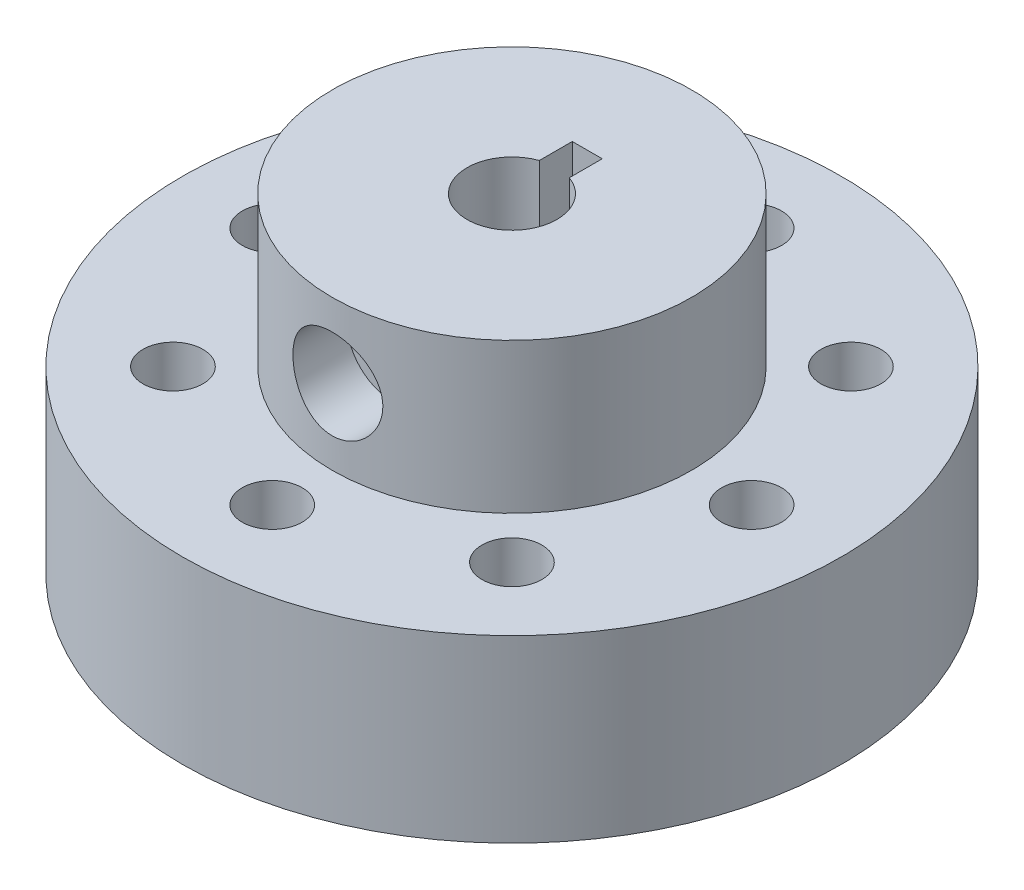
from build123d import *

# Parameters (mm, degrees)
SKETCH1_R           = 11
SKETCH1_R_2         = 1
BOSS_EXTRUDE1_DEPTH = 6
SKETCH2_R           = 4
CUT_EXTRUDE1_DEPTH  = 5.5
SKETCH3_R           = 6
BOSS_EXTRUDE2_DEPTH = 5
SKETCH6_R           = 1
CUT_EXTRUDE2_DEPTH  = 6
SKETCH6_3_R         = 1.5
SKETCH6_3_R_2       = 1
CUT_EXTRUDE3_DEPTH  = 2


with BuildPart() as part:
    # Sketch1 → Boss-Extrude1 (new body)
    with BuildSketch(Plane(origin=(0, 0, 0), x_dir=(1, 0, 0), z_dir=(0, 1, 0))):
        Circle(SKETCH1_R)
        with Locations((0, 8)):
            Circle(SKETCH1_R_2, mode=Mode.SUBTRACT)
        with Locations((5.656854249, 5.656854249)):
            Circle(SKETCH1_R_2, mode=Mode.SUBTRACT)
        with Locations((8, 0)):
            Circle(SKETCH1_R_2, mode=Mode.SUBTRACT)
        with Locations((5.656854249, -5.656854249)):
            Circle(SKETCH1_R_2, mode=Mode.SUBTRACT)
        with Locations((0, -8)):
            Circle(SKETCH1_R_2, mode=Mode.SUBTRACT)
        with Locations((-5.656854249, -5.656854249)):
            Circle(SKETCH1_R_2, mode=Mode.SUBTRACT)
        with Locations((-8, 0)):
            Circle(SKETCH1_R_2, mode=Mode.SUBTRACT)
        with Locations((-5.656854249, 5.656854249)):
            Circle(SKETCH1_R_2, mode=Mode.SUBTRACT)
    extrude(amount=BOSS_EXTRUDE1_DEPTH)

    # Sketch2 → Cut-Extrude1 (cut)
    with BuildSketch(Plane.XZ):
        Circle(SKETCH2_R)
    extrude(amount=-CUT_EXTRUDE1_DEPTH, mode=Mode.SUBTRACT)

    # Sketch3 → Boss-Extrude2 (add)
    with BuildSketch(Plane(origin=(0, 6, 0), x_dir=(1, 0, 0), z_dir=(0, 1, 0))):
        Circle(SKETCH3_R)
        with BuildLine():
            ThreePointArc((1.5, 0), (-0.866025404, -1.224744871), (-0.5, 1.414213562))
            Line((-0.5, 1.414213562), (-0.5, 2.514213562))
            Line((-0.5, 2.514213562), (0.5, 2.514213562))
            Line((0.5, 2.514213562), (0.5, 1.414213562))
            ThreePointArc((0.5, 1.414213562), (1.224744871, 0.866025404), (1.5, 0))
        make_face(mode=Mode.SUBTRACT)
    extrude(amount=BOSS_EXTRUDE2_DEPTH)

    # Sketch6 → Cut-Extrude2 (cut)
    with BuildSketch(Plane.XY.offset(6)):
        with Locations((0, 8.5)):
            Circle(SKETCH6_R)
    extrude(amount=-CUT_EXTRUDE2_DEPTH, mode=Mode.SUBTRACT)

    # Sketch6<3> → Cut-Extrude3 (cut)
    with BuildSketch(Plane.XY.offset(6)):
        with Locations((0, 8.5)):
            Circle(SKETCH6_3_R)
        with Locations((0, 8.5)):
            Circle(SKETCH6_3_R_2, mode=Mode.SUBTRACT)
    extrude(amount=-CUT_EXTRUDE3_DEPTH, mode=Mode.SUBTRACT)


solid = part.part
